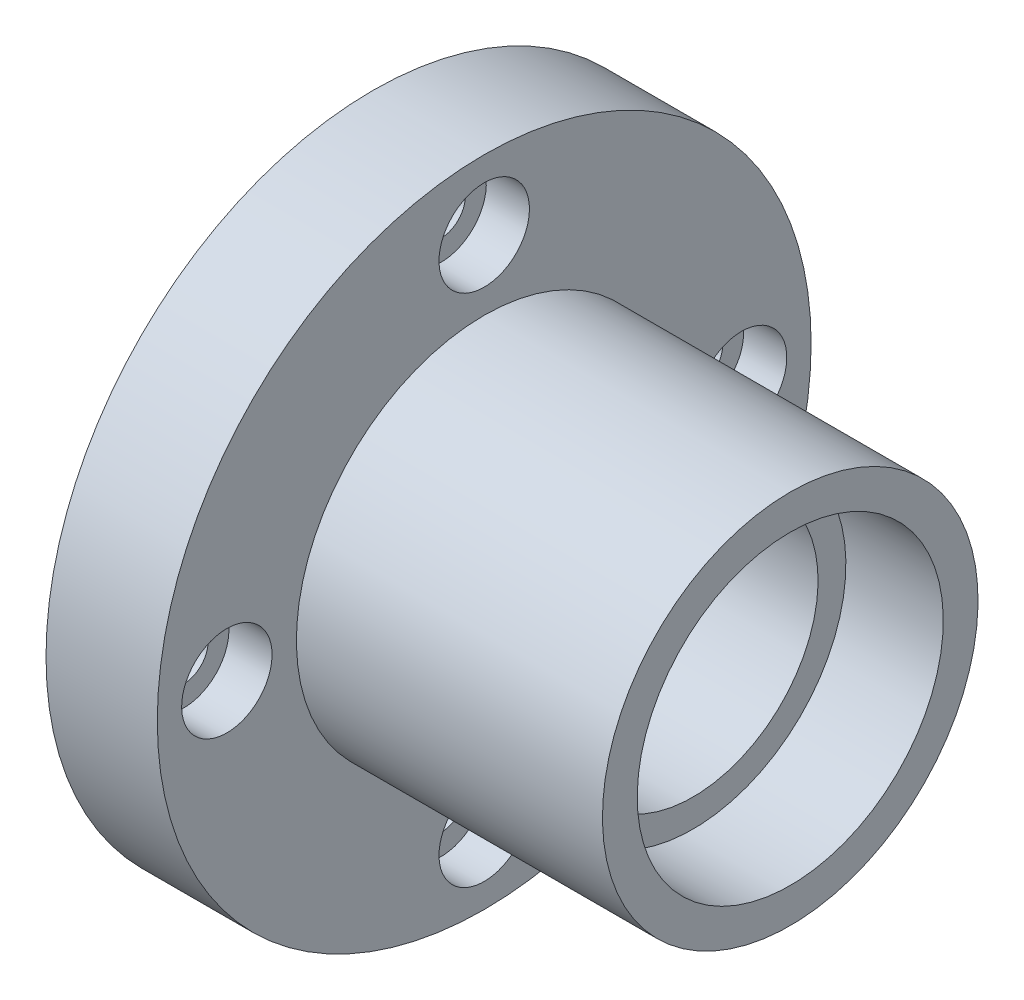
from build123d import *

# Parameters (mm, degrees)
SKETCH_2_R          = 3.25
CUT_EXTRUDE_1_DEPTH = 3.1
SKETCH_3_R          = 1.75
CUT_EXTRUDE_2_DEPTH = 40.855990767


with BuildPart() as part:
    # 草图1 → 旋转1 (revolve)
    with BuildSketch(Plane.XY):
        Polygon((-17.5, 13.5), (-17.5, 11), (-10.5, 11), (-10.5, 9), (10.5, 9), (10.5, 11), (17.5, 11), (17.5, 13.5), (-4.5, 13.5), (-4.5, 23.5), (-12.5, 23.5), (-12.5, 13.5), align=None)
    revolve(axis=Axis((0, 0, 0), (-1, 0, 0)))

    # 草图2 → 切除-拉伸1 (cut)
    with BuildSketch(Plane(origin=(-4.5, 0, 0), x_dir=(0, 0, -1), z_dir=(1, 0, 0))):
        with Locations(Location((0, 18.5, 0), (0, 0, 90))):
            Circle(SKETCH_2_R)
        with Locations(Location((0, -18.5, 0), (0, 0, 90))):
            Circle(SKETCH_2_R)
        with Locations(Location((18.5, 0, 0), (0, 0, 90))):
            Circle(SKETCH_2_R)
        with Locations(Location((-18.5, 0, 0), (0, 0, 90))):
            Circle(SKETCH_2_R)
    extrude(amount=-CUT_EXTRUDE_1_DEPTH, mode=Mode.SUBTRACT)

    # 草图3 → 切除-拉伸2 (cut, through all)
    with BuildSketch(Plane(origin=(-4.5, 0, 0), x_dir=(0, 0, -1), z_dir=(1, 0, 0))):
        with Locations(Location((0, 18.5, 0), (0, 0, 90))):
            Circle(SKETCH_3_R)
        with Locations(Location((18.5, 0, 0), (0, 0, 90))):
            Circle(SKETCH_3_R)
        with Locations(Location((0, -18.5, 0), (0, 0, 270))):
            Circle(SKETCH_3_R)
        with Locations(Location((-18.5, 0, 0), (0, 0, 90))):
            Circle(SKETCH_3_R)
    extrude(amount=-CUT_EXTRUDE_2_DEPTH, mode=Mode.SUBTRACT)


solid = part.part
